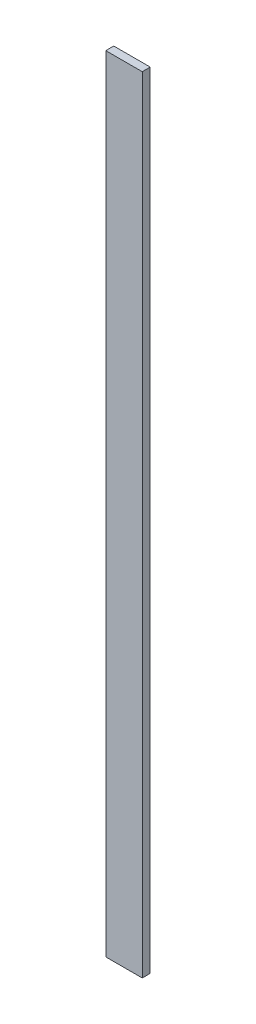
from build123d import *

# Parameters (mm, degrees)
SKETCH1_W           = 83.34375
SKETCH1_H           = 1792.2875
BOSS_EXTRUDE1_DEPTH = 18.25625


with BuildPart() as part:
    # Sketch1 → Boss-Extrude1 (new body)
    with BuildSketch(Plane.XY):
        Rectangle(SKETCH1_W, SKETCH1_H)
    extrude(amount=BOSS_EXTRUDE1_DEPTH)


solid = part.part
